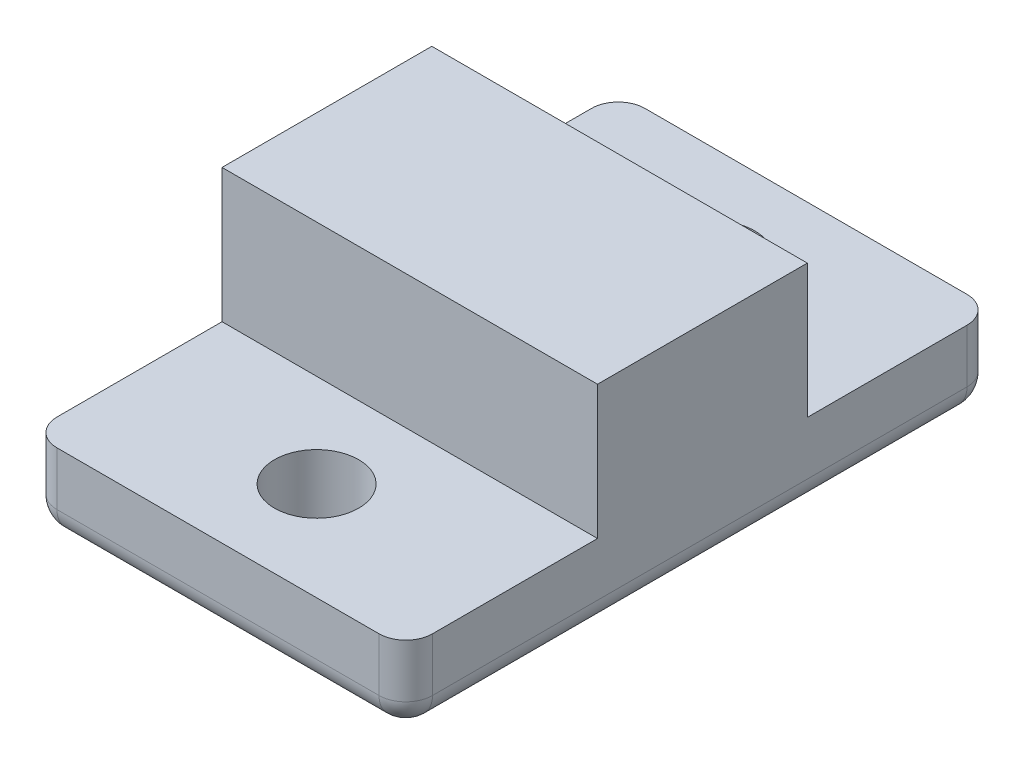
from build123d import *

# Parameters (mm, degrees)
SKETCH_1_W          = 14.05
SKETCH_1_H          = 7.85
EXTRUDE_1_DEPTH     = 5
EXTRUDE_2_DEPTH     = 3
SKETCH_3_R          = 1.575
CUT_EXTRUDE_1_DEPTH = 3
FILLET_2_R          = 1


with BuildPart() as part:
    # 草图1 → 凸台-拉伸1 (new body)
    with BuildSketch(Plane(origin=(0, 0, 0), x_dir=(1, 0, 0), z_dir=(0, 1, 0))):
        Rectangle(SKETCH_1_W, SKETCH_1_H)
    extrude(amount=EXTRUDE_1_DEPTH)

    # 草图2 → 凸台-拉伸2 (add)
    with BuildSketch(Plane(origin=(0, 0, 0), x_dir=(-1, 0, 0), z_dir=(0, -1, 0))):
        Polygon((-7.025, 3.925), (-7.025, 10.9), (7.025, 10.9), (7.025, 3.925), (7.025, -11.1), (-7.025, -11.1), align=None)
    extrude(amount=EXTRUDE_2_DEPTH)

    # 草图3 → 切除-拉伸1 (cut)
    with BuildSketch(Plane(origin=(0, 0, 0), x_dir=(1, 0, 0), z_dir=(0, 1, 0))):
        with Locations(Location((0, 7.4125, 0), (0, 0, 270))):
            Circle(SKETCH_3_R)
    cut_extrude_1 = extrude(amount=-CUT_EXTRUDE_1_DEPTH, mode=Mode.SUBTRACT)

    # 镜向1: 切除-拉伸1 across plane
    add(cut_extrude_1.mirror(Plane.XY), mode=Mode.SUBTRACT)

    # 圆角2
    fillet_2_edges = [part.edges().sort_by_distance(p)[0] for p in [
        (7.025, -1.5, 11.1),
        (-7.025, -1.5, 11.1),
        (-7.025, -1.5, -10.9),
        (7.025, -1.5, -10.9),
        (7.025, -3, 0.1),
        (0, -3, 11.1),
        (-7.025, -3, 0.1),
        (0, -3, -10.9),
    ]]
    fillet(fillet_2_edges, radius=FILLET_2_R)


solid = part.part
